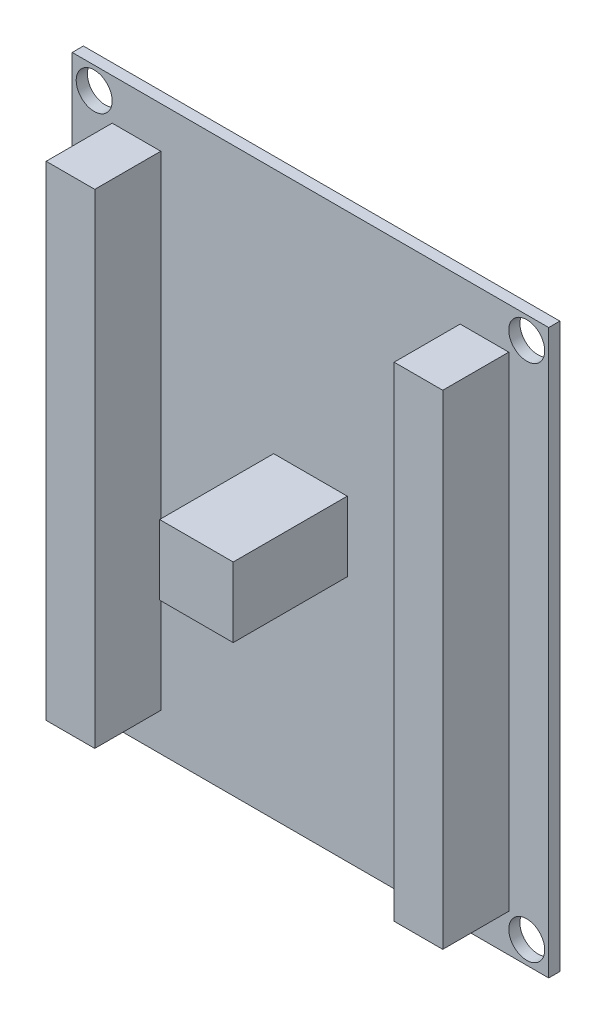
from build123d import *

# Parameters (mm, degrees)
SKETCH1_W           = 66.26
SKETCH1_H           = 78.34
BOSS_EXTRUDE1_DEPTH = 1.55
SKETCH2_R           = 2.5
CUT_EXTRUDE1_DEPTH  = 16.55
SKETCH3_R           = 2.5
CUT_EXTRUDE2_DEPTH  = 16.55
SKETCH4_W           = 6.76
SKETCH4_H           = 67.34
BOSS_EXTRUDE2_DEPTH = 9.18
SKETCH7_W           = 10.2328791
SKETCH7_H           = 9.710793432
BOSS_EXTRUDE3_DEPTH = 15.86


with BuildPart() as part:
    # Sketch1 → Boss-Extrude1 (new body)
    with BuildSketch(Plane.XY):
        Rectangle(SKETCH1_W, SKETCH1_H)
    extrude(amount=BOSS_EXTRUDE1_DEPTH)

    # Sketch2 → Cut-Extrude1 (cut)
    with BuildSketch(Plane.XY.offset(1.55)):
        with Locations((-30.076432851, 36.090160922)):
            Circle(SKETCH2_R)
    cut_extrude1 = extrude(amount=-CUT_EXTRUDE1_DEPTH, mode=Mode.SUBTRACT)

    # Sketch3 → Cut-Extrude2 (cut)
    with BuildSketch(Plane.XY.offset(1.55)):
        with Locations((-30.076432851, -36.07)):
            Circle(SKETCH3_R)
    cut_extrude2 = extrude(amount=-CUT_EXTRUDE2_DEPTH, mode=Mode.SUBTRACT)

    # Mirror1: Cut-Extrude1, Cut-Extrude2 across plane
    add(cut_extrude1.mirror(Plane(origin=(0, 0, 0), x_dir=(0, 0, 1), z_dir=(1, 0, 0))), mode=Mode.SUBTRACT)
    add(cut_extrude2.mirror(Plane(origin=(0, 0, 0), x_dir=(0, 0, 1), z_dir=(1, 0, 0))), mode=Mode.SUBTRACT)

    # Sketch4 → Boss-Extrude2 (add)
    with BuildSketch(Plane.XY.offset(1.55)):
        with Locations((-24.196432851, -0.24)):
            Rectangle(SKETCH4_W, SKETCH4_H)
    boss_extrude2 = extrude(amount=BOSS_EXTRUDE2_DEPTH)

    # Mirror2: Boss-Extrude2 across plane
    add(boss_extrude2.mirror(Plane(origin=(0, 0, 0), x_dir=(0, 0, 1), z_dir=(1, 0, 0))))

    # Sketch7 → Boss-Extrude3 (add)
    with BuildSketch(Plane.XY.offset(1.55)):
        Rectangle(SKETCH7_W, SKETCH7_H)
    extrude(amount=BOSS_EXTRUDE3_DEPTH)


solid = part.part
